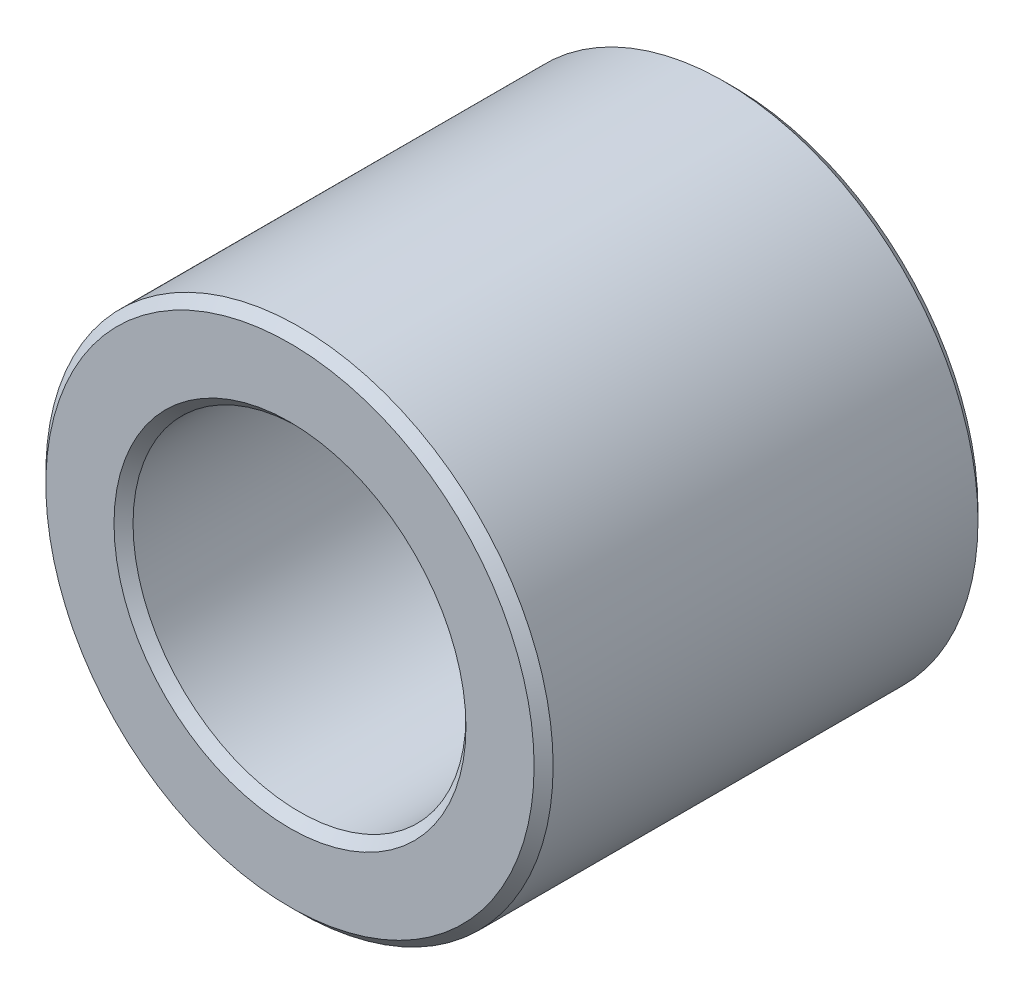
from build123d import *

# Parameters (mm, degrees)
SKETCH1_R           = 8
BOSS_EXTRUDE1_DEPTH = 14
SKETCH2_R           = 5.25
CUT_EXTRUDE1_DEPTH  = 14
CHAMFER7_SIZE       = 0.3


with BuildPart() as part:
    # Sketch1 → Boss-Extrude1 (new body)
    with BuildSketch(Plane.XY):
        Circle(SKETCH1_R)
    extrude(amount=BOSS_EXTRUDE1_DEPTH)

    # Sketch2 → Cut-Extrude1 (cut)
    with BuildSketch(Plane.XY):
        Circle(SKETCH2_R)
    extrude(amount=CUT_EXTRUDE1_DEPTH, mode=Mode.SUBTRACT)

    # Chamfer7
    chamfer7_edges = [part.edges().sort_by_distance(p)[0] for p in [
        (-8, 0, 0),
        (-8, 0, 14),
        (-5.25, 0, 0),
        (-5.25, 0, 14),
    ]]
    chamfer(chamfer7_edges, length=CHAMFER7_SIZE)


solid = part.part
